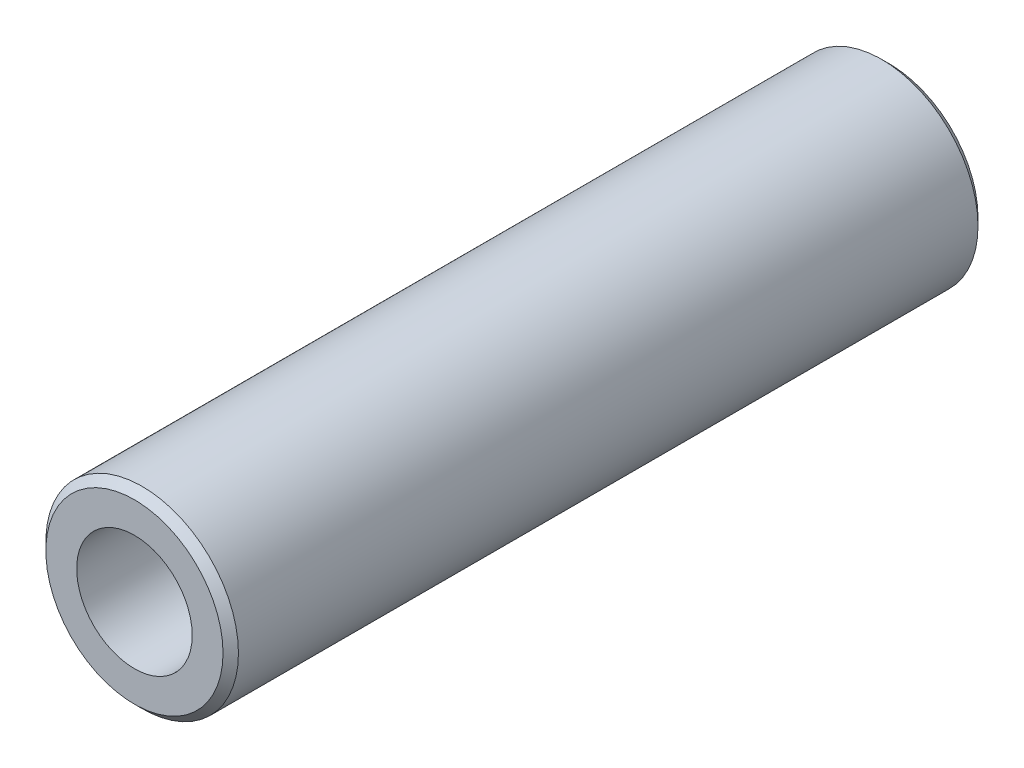
from build123d import *

# Parameters (mm, degrees)
SKETCH2_R           = 6.25
SKETCH2_R_2         = 3.75
EXTRUDE_THIN1_DEPTH = 24.5
CHAMFER1_SIZE       = 0.5


with BuildPart() as part:
    # Sketch2 → Extrude-Thin1 (new, symmetric)
    with BuildSketch(Plane.XY):
        Circle(SKETCH2_R)
        Circle(SKETCH2_R_2, mode=Mode.SUBTRACT)
    extrude(amount=EXTRUDE_THIN1_DEPTH, both=True)

    # Chamfer1
    chamfer1_edges = [part.edges().sort_by_distance(p)[0] for p in [
        (-6.25, 0, -24.5),
        (-6.25, 0, 24.5),
    ]]
    chamfer(chamfer1_edges, length=CHAMFER1_SIZE)


solid = part.part
